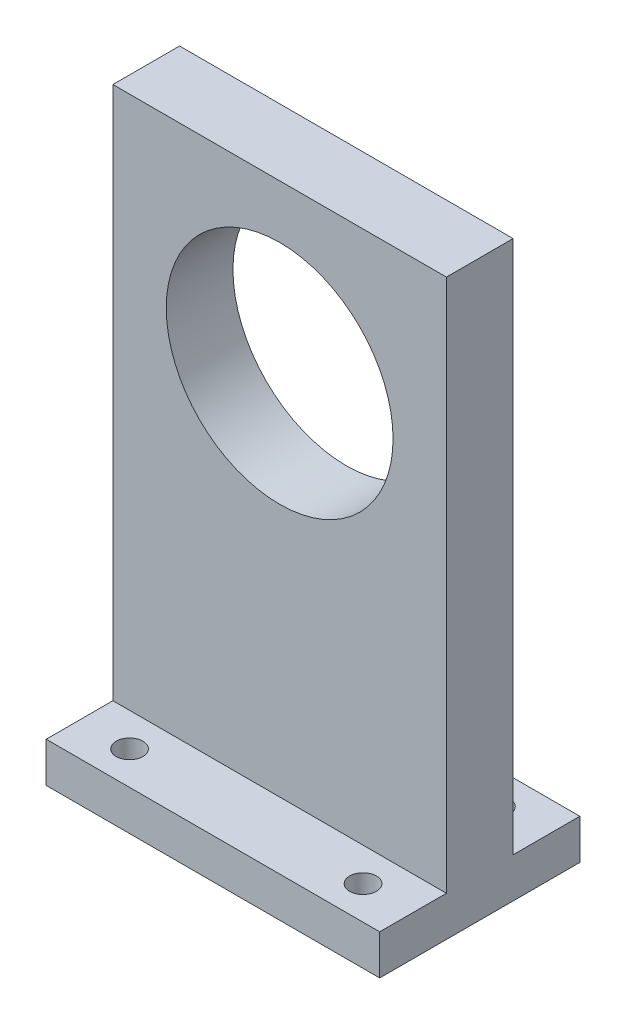
from build123d import *

# Parameters (mm, degrees)
SKETCH1_W           = 25
SKETCH1_H           = 15
BOSS_EXTRUDE1_DEPTH = 3
SKETCH2_W           = 25
SKETCH2_H           = 5
BOSS_EXTRUDE2_DEPTH = 40
SKETCH3_R           = 1
CUT_EXTRUDE1_DEPTH  = 43.573465915
SKETCH4_R           = 8.5
CUT_EXTRUDE2_DEPTH  = 46.883003389


with BuildPart() as part:
    # Sketch1 → Boss-Extrude1 (new body)
    with BuildSketch(Plane(origin=(0, 0, 0), x_dir=(1, 0, 0), z_dir=(0, 1, 0))):
        Rectangle(SKETCH1_W, SKETCH1_H)
    extrude(amount=BOSS_EXTRUDE1_DEPTH)

    # Sketch2 → Boss-Extrude2 (add)
    with BuildSketch(Plane(origin=(0, 3, 0), x_dir=(1, 0, 0), z_dir=(0, 1, 0))):
        Rectangle(SKETCH2_W, SKETCH2_H)
    extrude(amount=BOSS_EXTRUDE2_DEPTH)

    # Sketch3 → Cut-Extrude1 (cut, through all)
    with BuildSketch(Plane(origin=(0, 3, 0), x_dir=(1, 0, 0), z_dir=(0, 1, 0))):
        with Locations(Location((-8.75, 5, 0), (0, 0, 270))):
            Circle(SKETCH3_R)
        with Locations(Location((8.75, 5, 0), (0, 0, 270))):
            Circle(SKETCH3_R)
    cut_extrude1 = extrude(amount=-CUT_EXTRUDE1_DEPTH, mode=Mode.SUBTRACT)

    # Mirror1: Cut-Extrude1 across plane
    add(cut_extrude1.mirror(Plane.XY), mode=Mode.SUBTRACT)

    # Sketch4 → Cut-Extrude2 (cut, through all)
    with BuildSketch(Plane.XY.offset(2.5)):
        with Locations((0, 30.5)):
            Circle(SKETCH4_R)
    extrude(amount=-CUT_EXTRUDE2_DEPTH, mode=Mode.SUBTRACT)


solid = part.part
